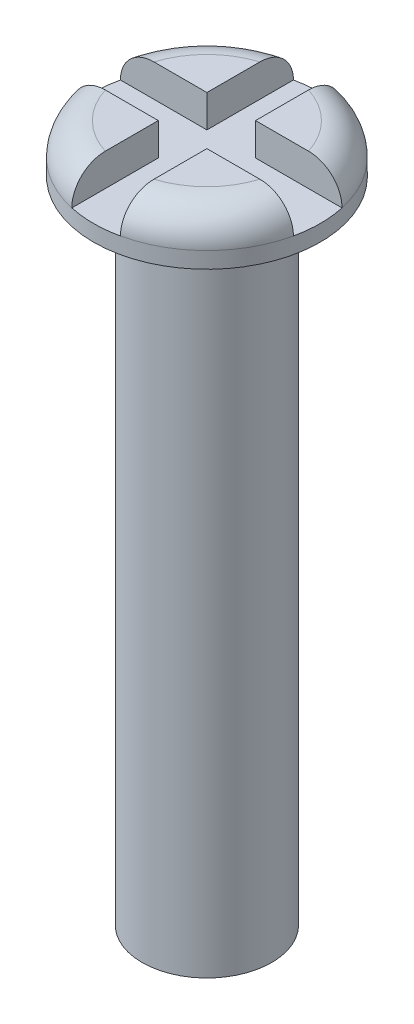
from build123d import *

# Parameters (mm, degrees)
SKETCH_1_R          = 1
EXTRUDE_1_DEPTH     = 10
SKETCH_2_R          = 1.75
EXTRUDE_2_DEPTH     = 0.75
FILLET_1_R          = 0.5
SKETCH_3_W          = 7.004697232
SKETCH_3_H          = 0.75
CUT_EXTRUDE_1_DEPTH = 0.5
SKETCH_4_W          = 0.75
SKETCH_4_H          = 3.75
CUT_EXTRUDE_2_DEPTH = 0.5


with BuildPart() as part:
    # 草图1 → 拉伸1 (new body)
    with BuildSketch(Plane(origin=(0, 0, 0), x_dir=(1, 0, 0), z_dir=(0, 1, 0))):
        with Locations(Location((0, 0, 0), (0, 0, 270))):
            Circle(SKETCH_1_R)
    extrude(amount=EXTRUDE_1_DEPTH)

    # 草图2 → 拉伸2 (add)
    with BuildSketch(Plane(origin=(0, 10, 0), x_dir=(-1, 0, 0), z_dir=(0, 1, 0))):
        with Locations(Location((0, 0, 0), (0, 0, 90))):
            Circle(SKETCH_2_R)
    extrude(amount=EXTRUDE_2_DEPTH)

    # 圆角1
    fillet_1_edges = [part.edges().sort_by_distance(p)[0] for p in [
        (0, 10.75, -1.75),
    ]]
    fillet(fillet_1_edges, radius=FILLET_1_R)

    # 草图3 → 切除-拉伸1 (cut)
    with BuildSketch(Plane(origin=(0, 10.75, 0), x_dir=(-1, 0, 0), z_dir=(0, 1, 0))):
        Rectangle(SKETCH_3_W, SKETCH_3_H)
    extrude(amount=-CUT_EXTRUDE_1_DEPTH, mode=Mode.SUBTRACT)

    # 草图4 → 切除-拉伸2 (cut)
    with BuildSketch(Plane(origin=(0, 10.75, 0), x_dir=(-1, 0, 0), z_dir=(0, 1, 0))):
        Rectangle(SKETCH_4_W, SKETCH_4_H)
    extrude(amount=-CUT_EXTRUDE_2_DEPTH, mode=Mode.SUBTRACT)


solid = part.part
